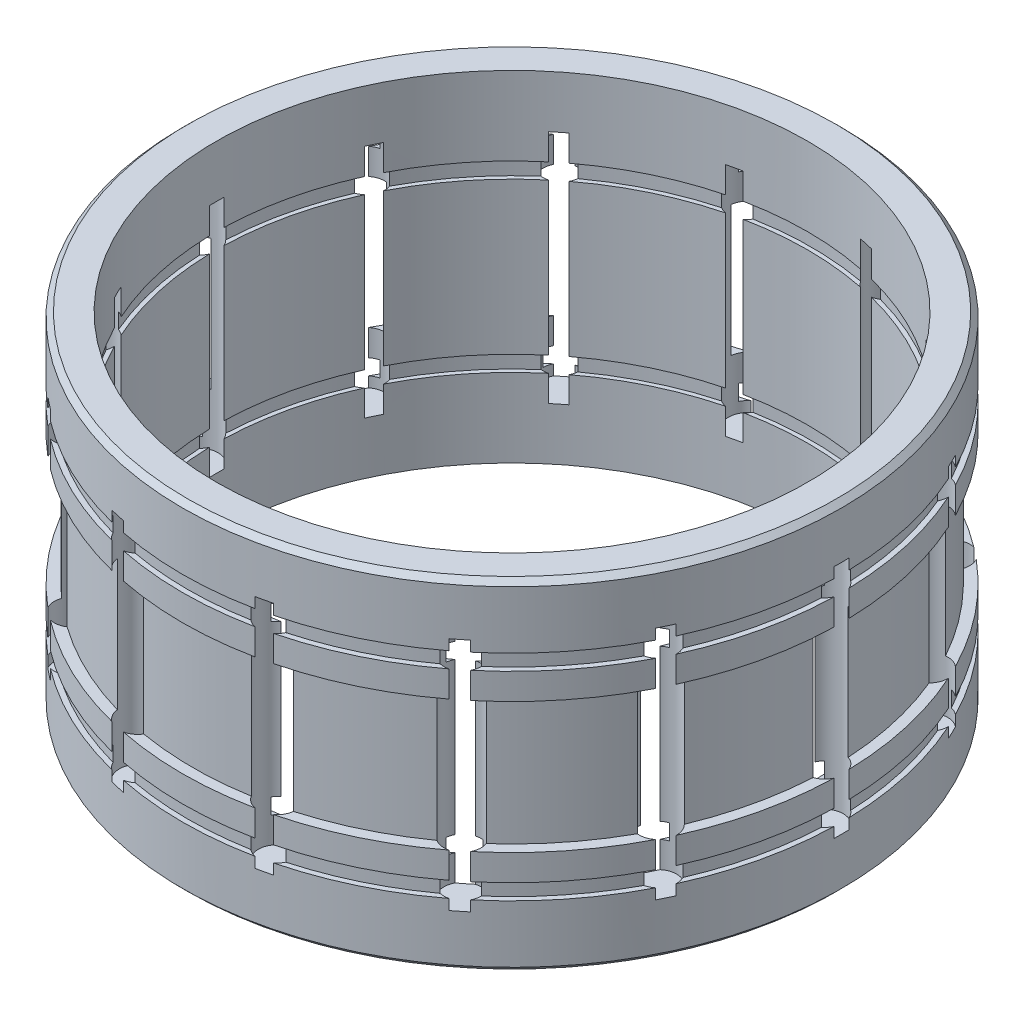
from build123d import *

# Parameters (mm, degrees)
SKETCH2_W         = 0.9017
SKETCH2_H         = 11.43
CIRPATTERN1_COUNT = 14
CHAMFER1_SIZE     = 0.254


with BuildPart() as part:
    # Sketch1 → Revolve1 (revolve)
    with BuildSketch(Plane.XY, mode=Mode.PRIVATE) as revolve1_sk:
        Polygon((16.002, 16.51), (16.002, 13.462), (15.748, 13.462), (15.748, 12.7), (16.002, 12.7), (16.002, 11.43), (15.494, 11.43), (15.494, 5.08), (16.002, 5.08), (16.002, 3.81), (15.748, 3.81), (15.748, 3.048), (16.002, 3.048), (16.002, 0), (14.351, 0), (14.351, 3.81), (14.5542, 3.81), (14.5542, 4.572), (14.351, 4.572), (14.351, 11.938), (14.5542, 11.938), (14.5542, 12.7), (14.351, 12.7), (14.351, 16.51), align=None)
    revolve(revolve1_sk.sketch.rotate(Axis((0, 0, 0), (0, 1, 0)), 90), axis=Axis((0, 0, 0), (0, 1, 0)))

    # Sketch2 → Cut-Revolve1 (revolve, cut)
    with BuildSketch(Plane.XY):
        with Locations((15.62735, 8.255)):
            Rectangle(SKETCH2_W, SKETCH2_H)
    cut_revolve1 = revolve(axis=Axis((15.1765, 13.97, 0), (0, -1, 0)), mode=Mode.SUBTRACT)

    # CirPattern1: Cut-Revolve1 ×14 about axis
    cirpattern1_axis = Axis((0, 0, 0), (0, 1, 0))
    for i in range(1, CIRPATTERN1_COUNT):
        add(cut_revolve1.rotate(cirpattern1_axis, i * 360 / CIRPATTERN1_COUNT), mode=Mode.SUBTRACT)

    # Chamfer1
    chamfer1_edges = [part.edges().sort_by_distance(p)[0] for p in [
        (0, 16.51, 16.002),
        (0, 0, 16.002),
    ]]
    chamfer(chamfer1_edges, length=CHAMFER1_SIZE)


solid = part.part
